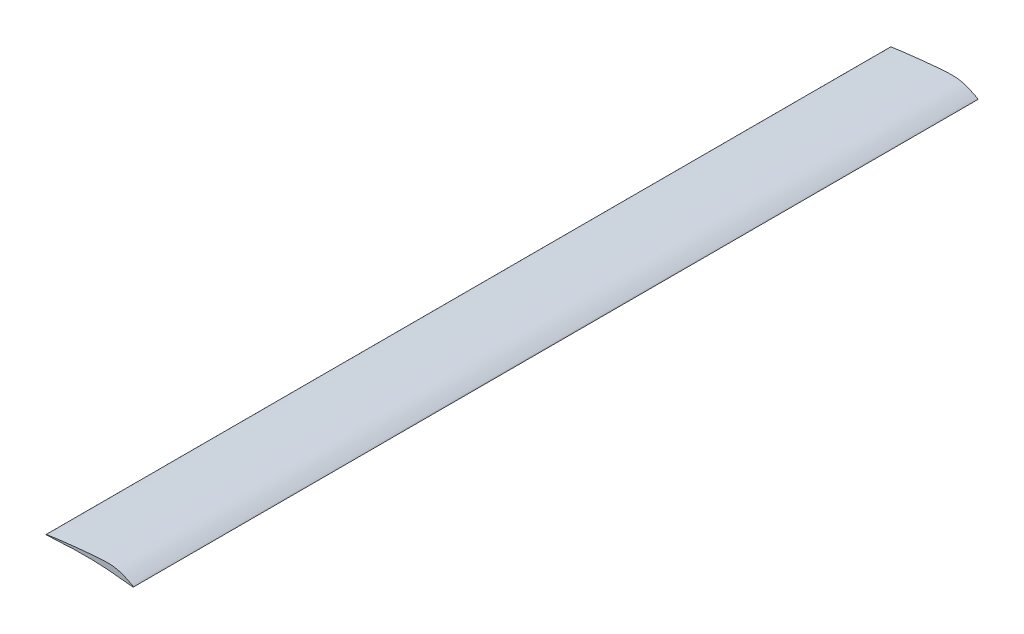
from build123d import *

# Parameters (mm, degrees)
BOSS_EXTRUDE1_DEPTH = 24384


with BuildPart() as part:
    # Sketch1 → Boss-Extrude1 (new body)
    with BuildSketch(Plane.XY):
        with BuildLine():
            add(Edge.make_bspline(
                [(0, 0), (-371.486611526, 198.954741641), (-874.499250657, 214.942042158), (-3054.949129022, -49.776610417), (-1650.6302793, 48.125276554), (-894.233180364, 42.177217277), (-485.552231982, 3.196028426), (122.628786697, -67.616869991), (28.989861105, -15.525917079), (0, 0)],
                knots=[0, 0, 0, 0, 0.196796904, 0.488014962, 0.611703159, 0.78850657, 0.952091524, 0.984642475, 1, 1, 1, 1], degree=3))
        make_face()
    extrude(amount=BOSS_EXTRUDE1_DEPTH)


solid = part.part
